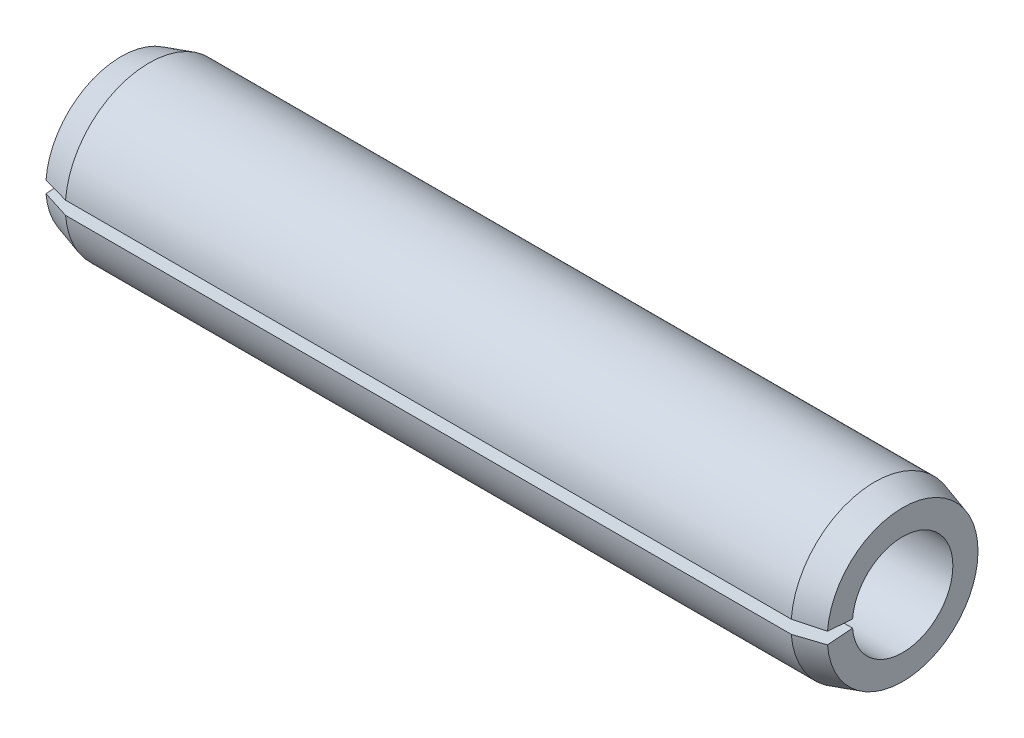
from build123d import *

# Parameters (mm, degrees)
GAP_DEPTH = 15.159802259


with BuildPart() as part:
    # Sketch1 → Base-Revolve (revolve)
    with BuildSketch(Plane.XY, mode=Mode.PRIVATE) as base_revolve_sk:
        Polygon((0, 0.9), (14, 0.9), (14, 1.35), (13.5, 1.5), (0.5, 1.5), (0, 1.35), align=None)
    revolve(base_revolve_sk.sketch.rotate(Axis((-9.525, 0, 0), (1, 0, 0)), 90), axis=Axis((-9.525, 0, 0), (1, 0, 0)))

    # Sketch2 → Gap (cut, through all)
    with BuildSketch(Plane(origin=(0, 0, 0), x_dir=(0, -1, 0), z_dir=(-1, 0, 0))):
        with BuildLine():
            Line((0, 0), (0.120042416, 1.525283521))
            ThreePointArc((0.120042416, 1.525283521), (0, 1.53), (-0.120042416, 1.525283521))
            Line((-0.120042416, 1.525283521), (0, 0))
        make_face()
    extrude(amount=-GAP_DEPTH, mode=Mode.SUBTRACT)


solid = part.part
